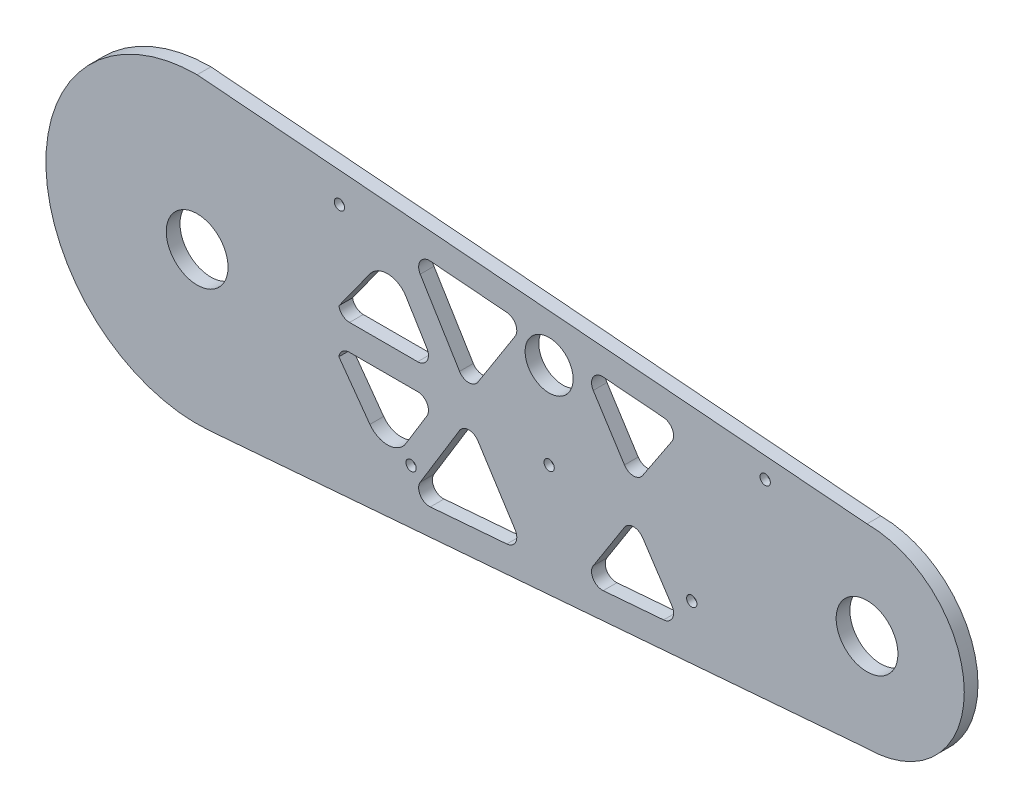
from build123d import *

# Parameters (mm, degrees)
SKETCH1_R             = 14.29385
SKETCH1_R_2           = 11.1125
BOSS_EXTRUDE1_DEPTH   = 6.35
CROQUIS1_R            = 2.38125
CORTAR_EXTRUIR1_DEPTH = 50
CROQUIS4_R            = 5
CORTAR_EXTRUIR2_DEPTH = 3.175
CROQUIS5_R            = 5
CORTAR_EXTRUIR3_DEPTH = 3.175
CROQUIS6_R            = 2.38125
CORTAR_EXTRUIR4_DEPTH = 10
CROQUIS7_R            = 2.38125
CORTAR_EXTRUIR5_DEPTH = 10
CROQUIS8_R            = 5
CORTAR_EXTRUIR6_DEPTH = 3.16


with BuildPart() as part:
    # Sketch1 → Boss-Extrude1 (new body)
    with BuildSketch(Plane.XY):
        with BuildLine():
            Line((0, 70), (310, 45))
            ThreePointArc((310, 45), (355, 0), (310, -45))
            Line((310, -45), (5.171398252, -69.808714643))
            ThreePointArc((5.171398252, -69.808714643), (-69.952162315, -2.587467389), (0, 70))
        make_face()
        Circle(SKETCH1_R, mode=Mode.SUBTRACT)
        with Locations((310, 0)):
            Circle(SKETCH1_R, mode=Mode.SUBTRACT)
        with Locations((162.878542763, 35)):
            Circle(SKETCH1_R_2, mode=Mode.SUBTRACT)
        with BuildLine():
            Line((107.898974887, 49.259511156), (143.314248041, 46.40344074))
            ThreePointArc((143.314248041, 46.40344074), (147.389908855, 43.644764005), (147.127454118, 38.730252238))
            Line((147.127454118, 38.730252238), (129.916226305, 11.754586611))
            ThreePointArc((129.916226305, 11.754586611), (125.651076231, 9.444205574), (121.433006579, 11.839462159))
            Line((121.433006579, 11.839462159), (103.228961238, 41.671198203))
            ThreePointArc((103.228961238, 41.671198203), (103.238833139, 46.896293531), (107.898974887, 49.259511156))
        make_face(mode=Mode.SUBTRACT)
        with BuildLine():
            Line((70.523244027, 6), (102.03004784, 6))
            ThreePointArc((102.03004784, 6), (106.3902351, 8.552804247), (106.298140539, 13.604493178))
            Line((106.298140539, 13.604493178), (96.590354482, 29.513051181))
            ThreePointArc((96.590354482, 29.513051181), (88.437172177, 34.296727565), (79.941746192, 30.151166228))
            Line((79.941746192, 30.151166228), (65.58297828, 10.229432452))
            ThreePointArc((65.58297828, 10.229432452), (67.271539685, 7.201787411), (70.523244027, 6))
        make_face(mode=Mode.SUBTRACT)
        with BuildLine():
            Line((219.623774494, 32.810522613), (206.130928429, 12.417497436))
            ThreePointArc((206.130928429, 12.417497436), (201.919524559, 10.176643248), (197.745901529, 12.48710226))
            Line((197.745901529, 12.48710226), (183.296864227, 35.133505128))
            ThreePointArc((183.296864227, 35.133505128), (183.227765467, 40.400743015), (187.913912204, 42.80669363))
            Line((187.913912204, 42.80669363), (215.855795571, 40.553315939))
            ThreePointArc((215.855795571, 40.553315939), (219.949772588, 37.757395035), (219.623774494, 32.810522613))
        make_face(mode=Mode.SUBTRACT)
        with BuildLine():
            Line((96.590354482, -29.513051181), (106.298140539, -13.604493178))
            ThreePointArc((106.298140539, -13.604493178), (106.3902351, -8.552804247), (102.03004784, -6))
            Line((102.03004784, -6), (70.523244027, -6))
            ThreePointArc((70.523244027, -6), (67.271539685, -7.201787411), (65.58297828, -10.229432452))
            Line((65.58297828, -10.229432452), (79.941746192, -30.151166228))
            ThreePointArc((79.941746192, -30.151166228), (88.437172177, -34.296727565), (96.590354482, -29.513051181))
        make_face(mode=Mode.SUBTRACT)
        with BuildLine():
            Line((187.913912204, -42.80669363), (215.855795571, -40.553315939))
            ThreePointArc((215.855795571, -40.553315939), (219.949772588, -37.757395035), (219.623774494, -32.810522613))
            Line((219.623774494, -32.810522613), (206.130928429, -12.417497436))
            ThreePointArc((206.130928429, -12.417497436), (201.919524559, -10.176643248), (197.745901529, -12.48710226))
            Line((197.745901529, -12.48710226), (183.296864227, -35.133505128))
            ThreePointArc((183.296864227, -35.133505128), (183.227765467, -40.400743015), (187.913912204, -42.80669363))
        make_face(mode=Mode.SUBTRACT)
        with BuildLine():
            Line((121.433006579, -11.839462159), (103.228961238, -41.671198203))
            ThreePointArc((103.228961238, -41.671198203), (103.238833139, -46.896293531), (107.898974887, -49.259511156))
            Line((107.898974887, -49.259511156), (143.314248041, -46.40344074))
            ThreePointArc((143.314248041, -46.40344074), (147.389908855, -43.644764005), (147.127454118, -38.730252238))
            Line((147.127454118, -38.730252238), (129.916226305, -11.754586611))
            ThreePointArc((129.916226305, -11.754586611), (125.651076231, -9.444205574), (121.433006579, -11.839462159))
        make_face(mode=Mode.SUBTRACT)
    extrude(amount=BOSS_EXTRUDE1_DEPTH)

    # Croquis1 → Cortar-Extruir1 (cut)
    with BuildSketch(Plane.XY.offset(6.35)):
        with Locations((98.995555235, -37.090103176)):
            Circle(CROQUIS1_R)
        with Locations((228.877351461, -26.519571404)):
            Circle(CROQUIS1_R)
    extrude(amount=-CORTAR_EXTRUIR1_DEPTH, mode=Mode.SUBTRACT)

    # Croquis4 → Cortar-Extruir2 (cut)
    with BuildSketch(Plane(origin=(0, 0, 0), x_dir=(-1, 0, 0), z_dir=(0, 0, -1))):
        with Locations((-228.877351461, -26.519571404)):
            Circle(CROQUIS4_R)
        with Locations((-98.995555235, -37.090103176)):
            Circle(CROQUIS4_R)
    extrude(amount=-CORTAR_EXTRUIR2_DEPTH, mode=Mode.SUBTRACT)

    # Croquis5 → Cortar-Extruir3 (cut)
    with BuildSketch(Plane(origin=(0, 0, 0), x_dir=(-1, 0, 0), z_dir=(0, 0, -1))):
        with Locations((-162.878542763, -5)):
            Circle(CROQUIS5_R)
    extrude(amount=-CORTAR_EXTRUIR3_DEPTH, mode=Mode.SUBTRACT)

    # Croquis6 → Cortar-Extruir4 (cut)
    with BuildSketch(Plane(origin=(0, 0, 0), x_dir=(-1, 0, 0), z_dir=(0, 0, -1))):
        with Locations((-162.878542763, -5)):
            Circle(CROQUIS6_R)
    extrude(amount=-CORTAR_EXTRUIR4_DEPTH, mode=Mode.SUBTRACT)

    # Croquis7 → Cortar-Extruir5 (cut)
    with BuildSketch(Plane(origin=(0, 0, 0), x_dir=(-1, 0, 0), z_dir=(0, 0, -1))):
        with Locations((-65.84135797, 50.868973694)):
            Circle(CROQUIS7_R)
        with Locations((-262.871569638, 39.210126075)):
            Circle(CROQUIS7_R)
    extrude(amount=-CORTAR_EXTRUIR5_DEPTH, mode=Mode.SUBTRACT)

    # Croquis8 → Cortar-Extruir6 (cut)
    with BuildSketch(Plane(origin=(0, 0, 0), x_dir=(-1, 0, 0), z_dir=(0, 0, -1))):
        with Locations((-262.871569638, 39.210126075)):
            Circle(CROQUIS8_R)
        with Locations((-65.84135797, 50.868973694)):
            Circle(CROQUIS8_R)
    extrude(amount=-CORTAR_EXTRUIR6_DEPTH, mode=Mode.SUBTRACT)


solid = part.part
